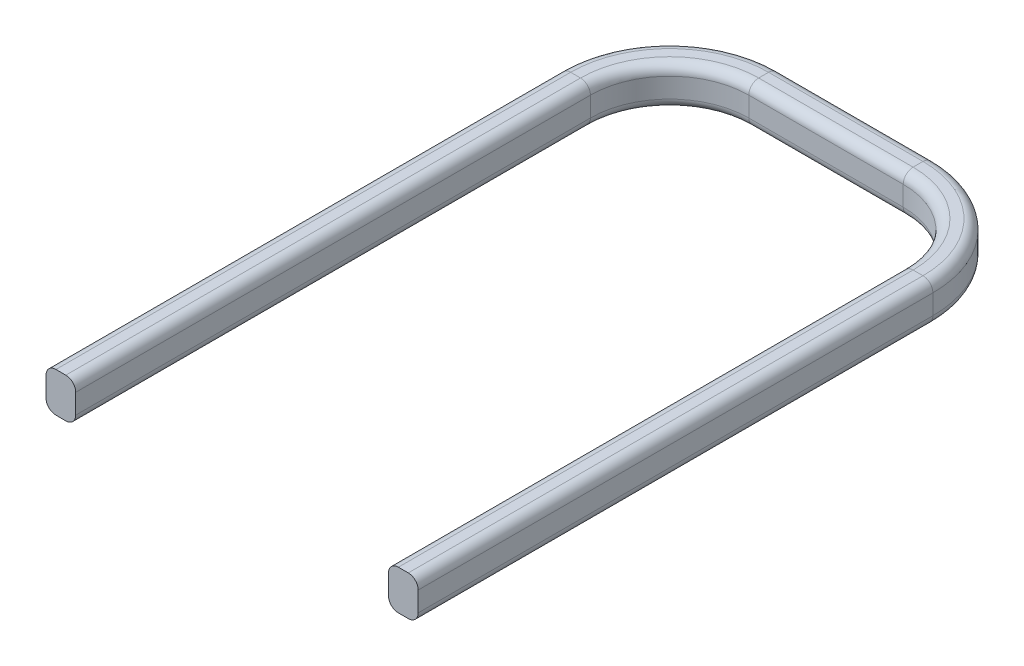
from build123d import *

# Parameters (mm, degrees)
SKETCH2_W = 0.75
SKETCH2_H = 1
FILLET1_R = 0.25


with BuildPart() as part:
    # Sweep1: sweep along a path in Sketch1
    with BuildLine(Plane(origin=(0, 0, 0), x_dir=(1, 0, 0), z_dir=(0, 1, 0))) as sweep1_path:
        Line((-3.95, 0), (-3.95, 13))
        ThreePointArc((-3.95, 13), (-3.364213562, 14.414213562), (-1.95, 15))
        Line((-1.95, 15), (1.95, 15))
        ThreePointArc((1.95, 15), (3.364213562, 14.414213562), (3.95, 13))
        Line((3.95, 13), (3.95, 0))
    # Sketch2 → Sweep1 (sweep)
    with BuildSketch(Plane.XY):
        with Locations((-4.325, 0.5)):
            Rectangle(SKETCH2_W, SKETCH2_H)
    sweep(path=sweep1_path.line)

    # Fillet1
    fillet1_edges = [part.edges().sort_by_distance(p)[0] for p in [
        (3.95, 1, -6.5),
        (4.7, 1, -6.5),
        (4.7, 0, -6.5),
        (-3.95, 0, -6.5),
        (-3.95, 1, -6.5),
        (-4.7, 1, -6.5),
        (-4.7, 0, -6.5),
        (-3.364213562, 0, -14.414213562),
        (-3.364213562, 1, -14.414213562),
        (-3.894543648, 1, -14.944543648),
        (-3.894543648, 0, -14.944543648),
        (0, 0, -15),
        (0, 1, -15),
        (0, 1, -15.75),
        (0, 0, -15.75),
        (3.364213562, 0, -14.414213562),
        (3.364213562, 1, -14.414213562),
        (3.894543648, 1, -14.944543648),
        (3.894543648, 0, -14.944543648),
        (3.95, 0, -6.5),
    ]]
    fillet(fillet1_edges, radius=FILLET1_R)


solid = part.part
